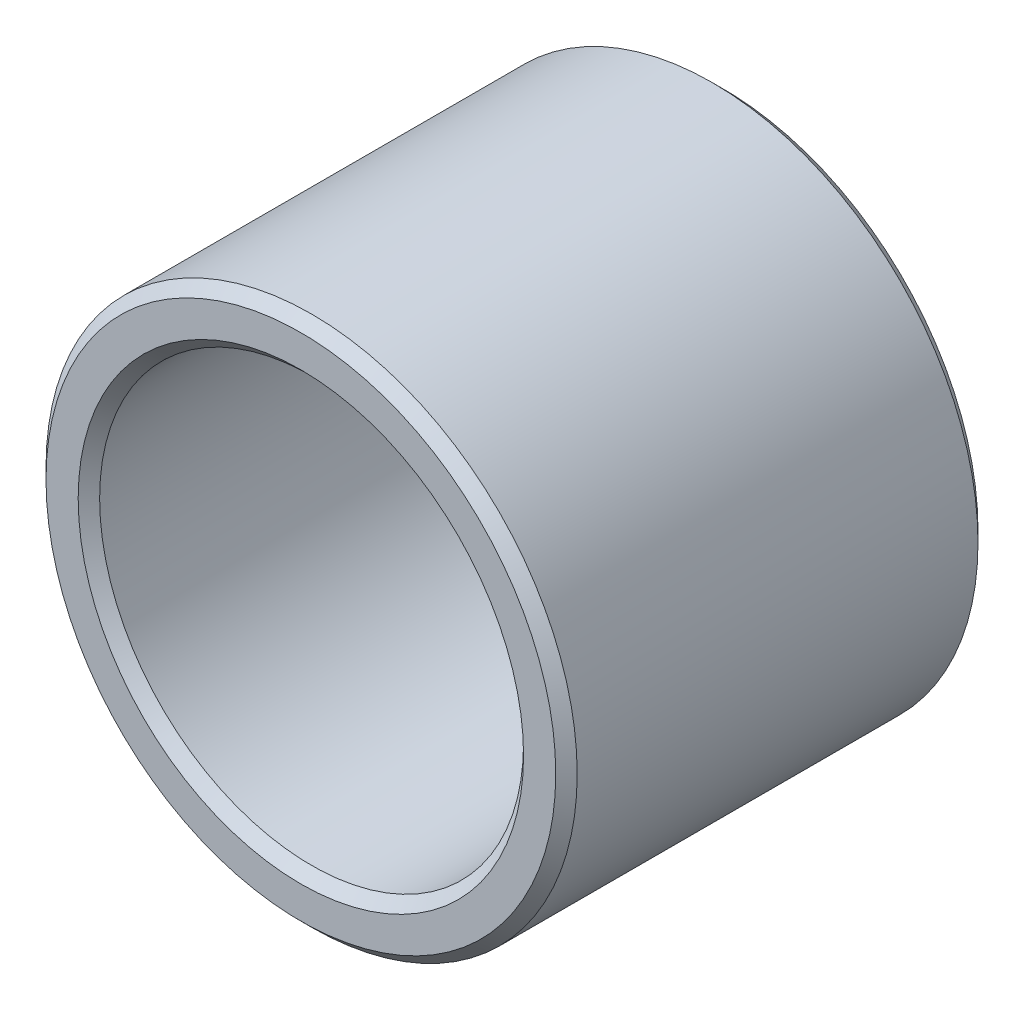
from build123d import *

# Parameters (mm, degrees)
BOSS_EXTRUDE1_DEPTH      = 3.175
BOSS_EXTRUDE1_DEPTH_BACK = 3.175
SKETCH14_R               = 3.99415
SKETCH14_R_2             = 3.1877
CHAMFER1_SIZE            = 0.16129


with BuildPart() as part:
    # Sketch14 → Boss-Extrude1 (new, two sides: drawn at the far end of the back side and taken through both)
    with BuildSketch(Plane.XY.offset(-BOSS_EXTRUDE1_DEPTH_BACK)):
        Circle(SKETCH14_R)
        Circle(SKETCH14_R_2, mode=Mode.SUBTRACT)
    extrude(amount=BOSS_EXTRUDE1_DEPTH + BOSS_EXTRUDE1_DEPTH_BACK)

    # Chamfer1
    chamfer1_edges = [part.edges().sort_by_distance(p)[0] for p in [
        (-3.99415, 0, -3.175),
        (-3.1877, 0, -3.175),
        (-3.99415, 0, 3.175),
        (-3.1877, 0, 3.175),
    ]]
    chamfer(chamfer1_edges, length=CHAMFER1_SIZE)


solid = part.part
